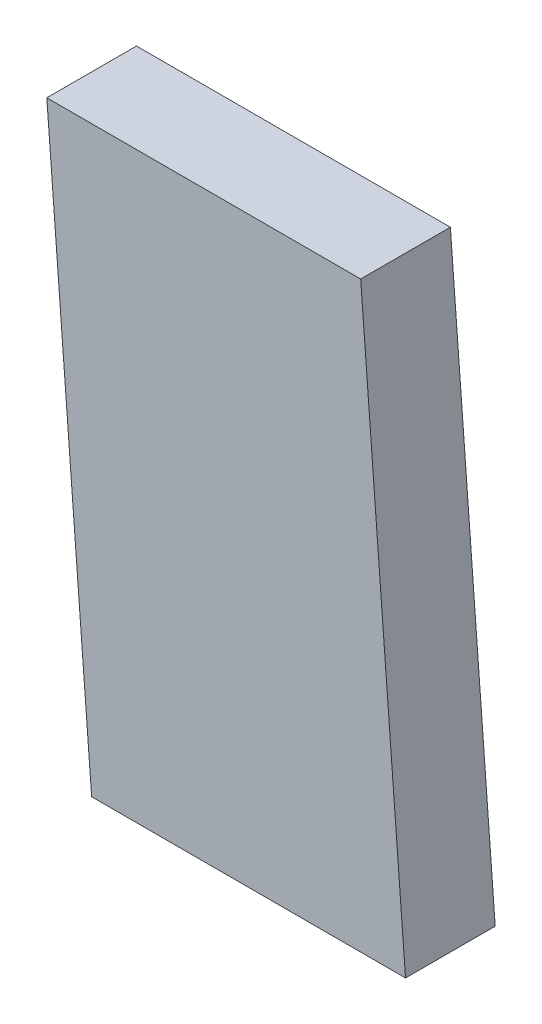
from build123d import *

# Parameters (mm, degrees)
BOSS_EXTRUDE1_DEPTH = 20


with BuildPart() as part:
    # Sketch1 → Boss-Extrude1 (new body)
    with BuildSketch(Plane.XY):
        Polygon((4500, 450), (4490, 580), (4560, 580), (4570, 450), align=None)
    extrude(amount=BOSS_EXTRUDE1_DEPTH)


solid = part.part
